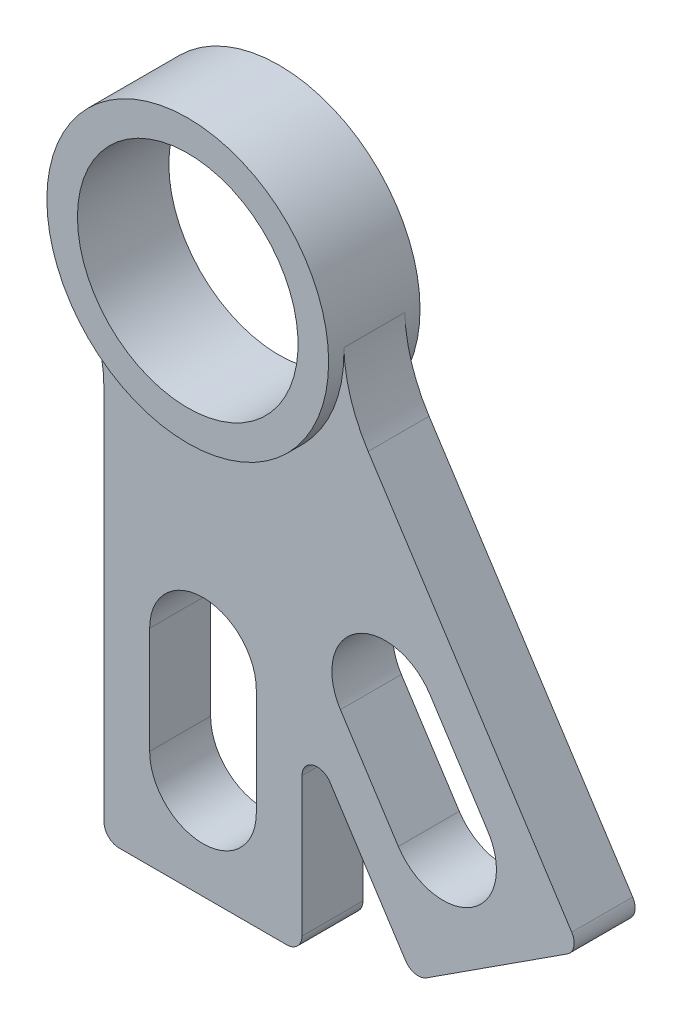
from build123d import *

# Parameters (mm, degrees)
SKETCH1_R           = 11.495405
BOSS_EXTRUDE2_DEPTH = 4.7625
BOSS_EXTRUDE3_DEPTH = 3.175
FILLET1_R           = 1.5875


with BuildPart() as part:
    # Sketch1 → Boss-Extrude2 (new, symmetric)
    with BuildSketch(Plane.XY):
        with BuildLine():
            ThreePointArc((14.672983865, 0.491098707), (-4.158599684, 14.079903484), (-12.585193267, -7.559797873))
            ThreePointArc((-12.585193267, -7.559797873), (4.158599684, -14.079903484), (14.672983865, 0.491098707))
        make_face()
        Circle(SKETCH1_R, mode=Mode.SUBTRACT)
    extrude(amount=BOSS_EXTRUDE2_DEPTH, both=True)

    # Sketch1<4> → Boss-Extrude3 (add, symmetric)
    with BuildSketch(Plane.XY):
        with BuildLine():
            ThreePointArc((-12.585193267, -7.559797873), (-10.89585042, -11.492870345), (-10.31875, -15.734319794))
            Line((-10.31875, -15.734319794), (-10.31875, -56.374319794))
            Line((-10.31875, -56.374319794), (10.31875, -56.374319794))
            Line((10.31875, -56.374319794), (10.31875, -34.936520731))
            Line((10.31875, -34.936520731), (21.966281014, -52.934138627))
            Line((21.966281014, -52.934138627), (39.292025986, -41.721424085))
            Line((39.292025986, -41.721424085), (17.211603503, -7.603033986))
            ThreePointArc((17.211603503, -7.603033986), (15.391641433, -3.728672569), (14.672983865, 0.491098707))
            ThreePointArc((14.672983865, 0.491098707), (4.158599684, -14.079903484), (-12.585193267, -7.559797873))
        make_face()
        with BuildLine():
            ThreePointArc((5.55625, -46.055569794), (0, -51.611819794), (-5.55625, -46.055569794))
            Line((-5.55625, -46.055569794), (-5.55625, -34.943069794))
            ThreePointArc((-5.55625, -34.943069794), (0, -29.386819794), (5.55625, -34.943069794))
            Line((5.55625, -34.943069794), (5.55625, -46.055569794))
        make_face(mode=Mode.SUBTRACT)
        with BuildLine():
            ThreePointArc((29.687419875, -35.646101109), (28.04160399, -43.329532516), (20.358172583, -41.683716631))
            Line((20.358172583, -41.683716631), (14.32055706, -32.354469339))
            ThreePointArc((14.32055706, -32.354469339), (15.966372945, -24.671037931), (23.649804353, -26.316853816))
            Line((23.649804353, -26.316853816), (29.687419875, -35.646101109))
        make_face(mode=Mode.SUBTRACT)
    extrude(amount=BOSS_EXTRUDE3_DEPTH, both=True)

    # Fillet1
    fillet1_edges = [part.edges().sort_by_distance(p)[0] for p in [
        (-10.31875, -56.374319794, 0),
        (39.292025986, -41.721424085, 0),
        (10.31875, -56.374319794, 0),
        (21.966281014, -52.934138627, 0),
        (10.31875, -34.936520731, 0),
    ]]
    fillet(fillet1_edges, radius=FILLET1_R)


solid = part.part
